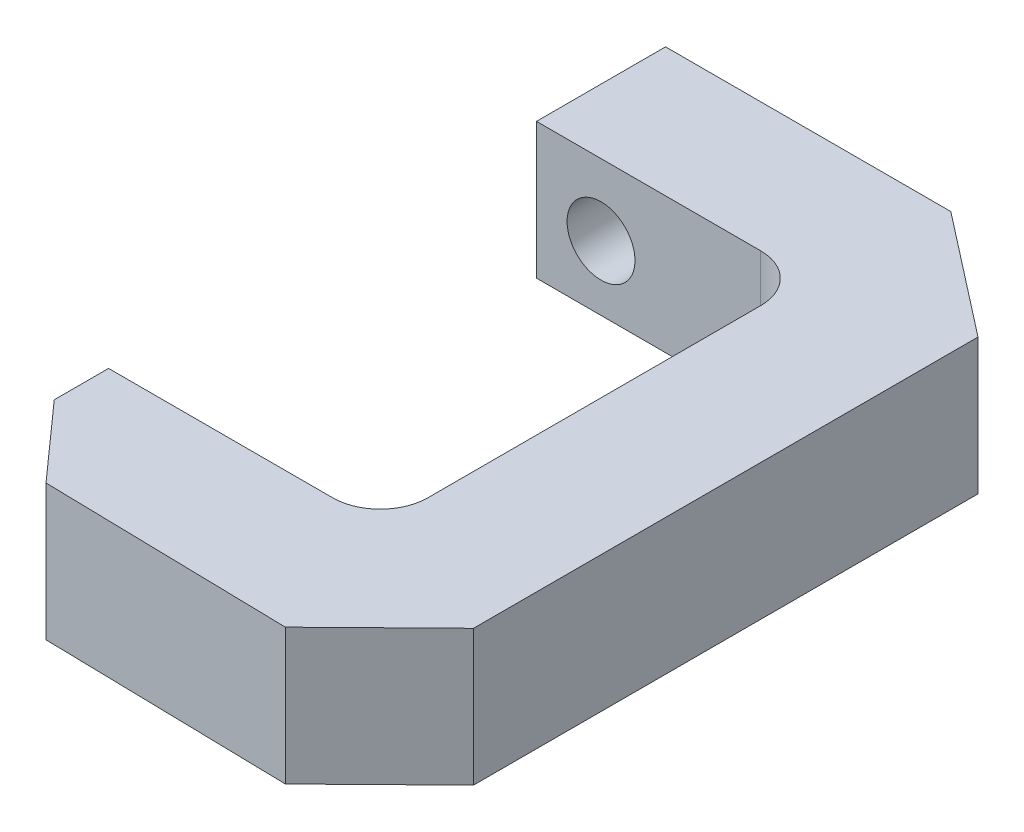
from build123d import *

# Parameters (mm, degrees)
BOSS_EXTRUDE1_DEPTH = 20
CUT_EXTRUDE1_DEPTH  = 20
CUT_EXTRUDE2_DEPTH  = 20
SKETCH4_W           = 36.5
SKETCH4_H           = 63
CUT_EXTRUDE3_DEPTH  = 20
FILLET1_R           = 7
FILLET2_R           = 7
SKETCH5_R           = 5
CUT_EXTRUDE4_DEPTH  = 20
CUT_EXTRUDE5_DEPTH  = 20
FILLET3_R           = 7
FILLET4_R           = 7


with BuildPart() as part:
    # Sketch1 → Boss-Extrude1 (new body)
    with BuildSketch(Plane(origin=(0, 0, 0), x_dir=(1, 0, 0), z_dir=(0, 1, 0))):
        Polygon((0, 0), (0, 101), (60, 101), (60, -1.275996113), align=None)
    extrude(amount=BOSS_EXTRUDE1_DEPTH)

    # Sketch2 → Cut-Extrude1 (cut)
    with BuildSketch(Plane(origin=(0, 20, 0), x_dir=(1, 0, 0), z_dir=(0, 1, 0))):
        Polygon((60, 101), (42, 101), (60, 87), align=None)
    extrude(amount=-CUT_EXTRUDE1_DEPTH, mode=Mode.SUBTRACT)

    # Sketch3 → Cut-Extrude2 (cut)
    with BuildSketch(Plane(origin=(0, 20, 0), x_dir=(1, 0, 0), z_dir=(0, 1, 0))):
        Polygon((60, -1.275996113), (46, -0.978263686), (60, 12.724003887), align=None)
        Polygon((10, -0.212666019), (0, 0), (0, 11), align=None)
    extrude(amount=-CUT_EXTRUDE2_DEPTH, mode=Mode.SUBTRACT)

    # Sketch4 → Cut-Extrude3 (cut)
    with BuildSketch(Plane(origin=(0, 20, 0), x_dir=(1, 0, 0), z_dir=(0, 1, 0))):
        with Locations((18.25, 50.5)):
            Rectangle(SKETCH4_W, SKETCH4_H)
    extrude(amount=-CUT_EXTRUDE3_DEPTH, mode=Mode.SUBTRACT)

    # Fillet1
    fillet1_edges = [part.edges().sort_by_distance(p)[0] for p in [
        (36.5, 10, -82),
    ]]
    fillet(fillet1_edges, radius=FILLET1_R)

    # Fillet2
    fillet2_edges = [part.edges().sort_by_distance(p)[0] for p in [
        (36.5, 10, -19),
    ]]
    fillet(fillet2_edges, radius=FILLET2_R)

    # Sketch5 → Cut-Extrude4 (cut)
    with BuildSketch(Plane(origin=(0, 0, -101), x_dir=(-1, 0, 0), z_dir=(0, 0, -1))):
        with Locations((-9.5, 9.5)):
            Circle(SKETCH5_R)
    extrude(amount=-CUT_EXTRUDE4_DEPTH, mode=Mode.SUBTRACT)

    # Sketch7 → Cut-Extrude5 (cut)
    with BuildSketch(Plane(origin=(0, 20, 0), x_dir=(1, 0, 0), z_dir=(0, 1, 0))):
        Polygon((29.5, 82), (40, 82), (40, 19), (0, 19), (0, 82), align=None)
    extrude(amount=-CUT_EXTRUDE5_DEPTH, mode=Mode.SUBTRACT)

    # Fillet3
    fillet3_edges = [part.edges().sort_by_distance(p)[0] for p in [
        (40, 10, -82),
    ]]
    fillet(fillet3_edges, radius=FILLET3_R)

    # Fillet4
    fillet4_edges = [part.edges().sort_by_distance(p)[0] for p in [
        (40, 10, -19),
    ]]
    fillet(fillet4_edges, radius=FILLET4_R)


solid = part.part
